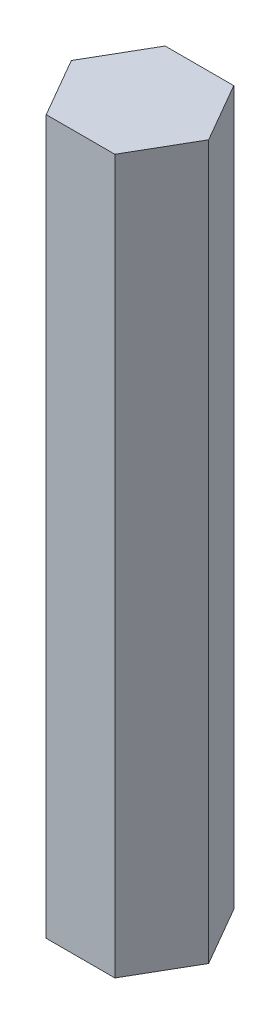
from build123d import *

# Parameters (mm, degrees)
BOSS_EXTRUDE1_DEPTH = 38.1


with BuildPart() as part:
    # Sketch1 → Boss-Extrude1 (new, symmetric)
    with BuildSketch(Plane(origin=(0, 0, 0), x_dir=(1, 0, 0), z_dir=(0, 1, 0))):
        Polygon((3.666174209, 6.35), (-3.666174209, 6.35), (-7.332348419, 0), (-3.666174209, -6.35), (3.666174209, -6.35), (7.332348419, 0), align=None)
    extrude(amount=BOSS_EXTRUDE1_DEPTH, both=True)


solid = part.part
